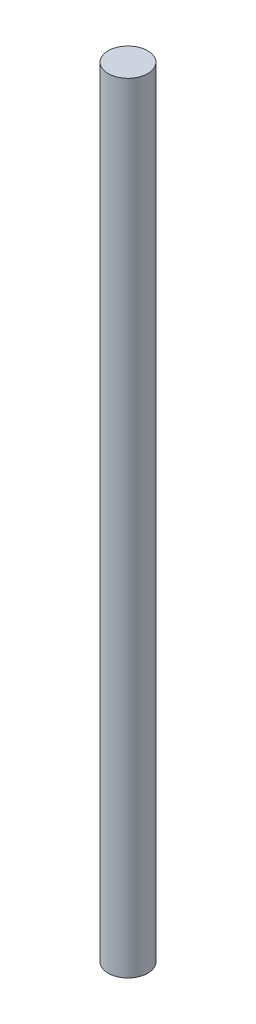
from build123d import *

# Parameters (mm, degrees)
SKETCH1_R           = 12.7
BOSS_EXTRUDE1_DEPTH = 500


with BuildPart() as part:
    # Sketch1 → Boss-Extrude1 (new body)
    with BuildSketch(Plane(origin=(0, 0, 0), x_dir=(1, 0, 0), z_dir=(0, 1, 0))):
        with Locations(Location((0, 0, 0), (0, 0, 270))):
            Circle(SKETCH1_R)
    extrude(amount=BOSS_EXTRUDE1_DEPTH)


solid = part.part
